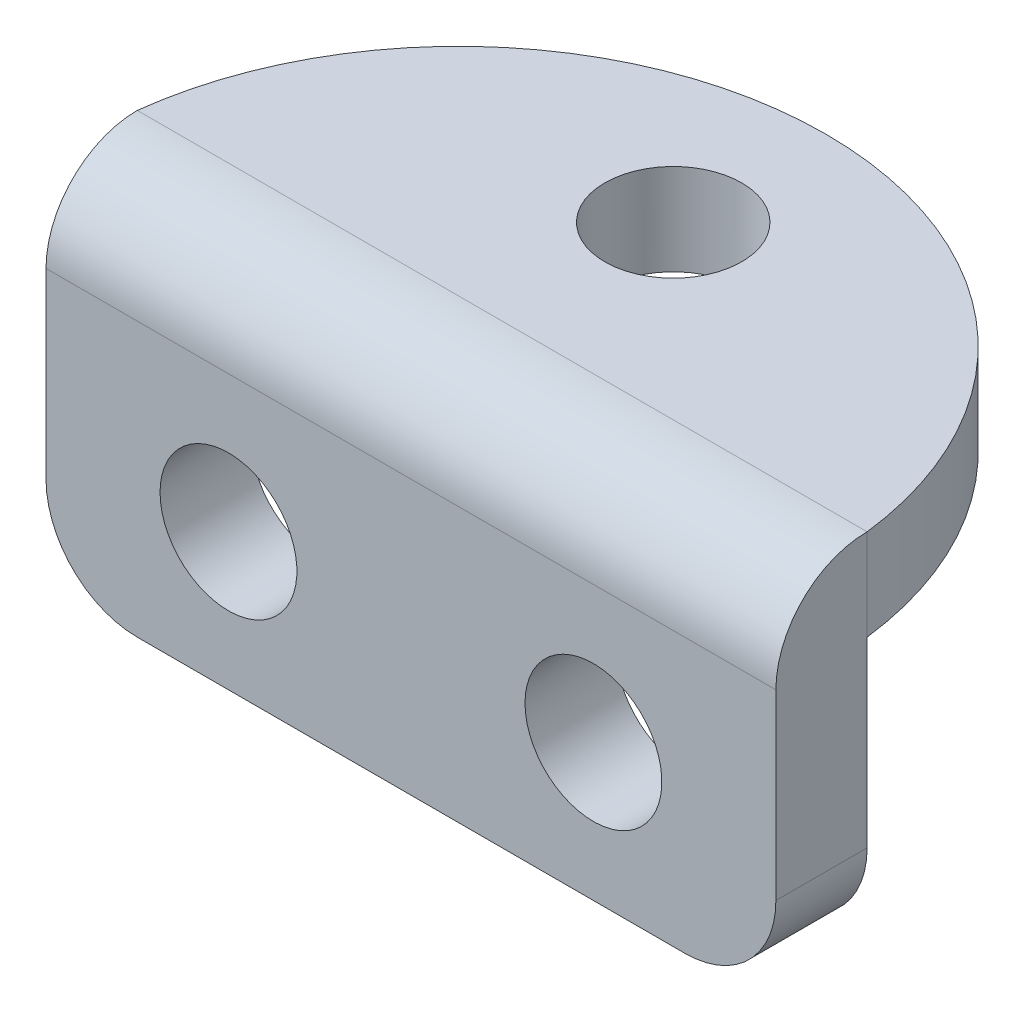
from build123d import *

# Parameters (mm, degrees)
BOSS_EXTRUDE1_DEPTH = 2
BOSS_EXTRUDE2_DEPTH = 2
BOSS_EXTRUDE3_DEPTH = 16
SKETCH10_R          = 1.5
CUT_EXTRUDE1_DEPTH  = 19.503375178
SKETCH13_R          = 1.5
CUT_EXTRUDE2_DEPTH  = 4


with BuildPart() as part:
    # Sketch1 → Boss-Extrude1 (new body)
    with BuildSketch(Plane.XY):
        with BuildLine():
            Line((0, 0), (0, -4))
            ThreePointArc((0, -4), (0.585786438, -5.414213562), (2, -6))
            Line((2, -6), (14, -6))
            ThreePointArc((14, -6), (15.414213562, -5.414213562), (16, -4))
            Line((16, -4), (16, 0))
            Line((16, 0), (0, 0))
        make_face()
    extrude(amount=BOSS_EXTRUDE1_DEPTH)

    # Sketch9 → Boss-Extrude3 (add)
    with BuildSketch(Plane.ZY):
        with BuildLine():
            Line((0, 2), (0, 0))
            Line((0, 0), (2, 0))
            ThreePointArc((2, 0), (1.414213562, 1.414213562), (0, 2))
        make_face()
    extrude(amount=-BOSS_EXTRUDE3_DEPTH)

    # Sketch10 → Cut-Extrude1 (cut, through all)
    with BuildSketch(Plane(origin=(0, 0, 0), x_dir=(-1, 0, 0), z_dir=(0, 0, -1))):
        with Locations((-12, -3)):
            Circle(SKETCH10_R)
        with Locations((-4, -3)):
            Circle(SKETCH10_R)
    extrude(amount=-CUT_EXTRUDE1_DEPTH, mode=Mode.SUBTRACT)


with BuildPart() as body_2:
    # Sketch5 → Boss-Extrude2 (new body)
    with BuildSketch(Plane(origin=(0, 0, 0), x_dir=(1, 0, 0), z_dir=(0, 1, 0))):
        with BuildLine():
            Line((0, 0), (16, 0))
            ThreePointArc((16, 0), (8, 7.097527245), (0, 0))
        make_face()
    extrude(amount=BOSS_EXTRUDE2_DEPTH)

    # Sketch13 → Cut-Extrude2 (cut)
    with BuildSketch(Plane(origin=(0, 2, 0), x_dir=(1, 0, 0), z_dir=(0, 1, 0))):
        with Locations(Location((8, 3.75, 0), (0, 0, 180))):
            Circle(SKETCH13_R)
    extrude(amount=-CUT_EXTRUDE2_DEPTH, mode=Mode.SUBTRACT)


solid = Compound([part.part, body_2.part])
